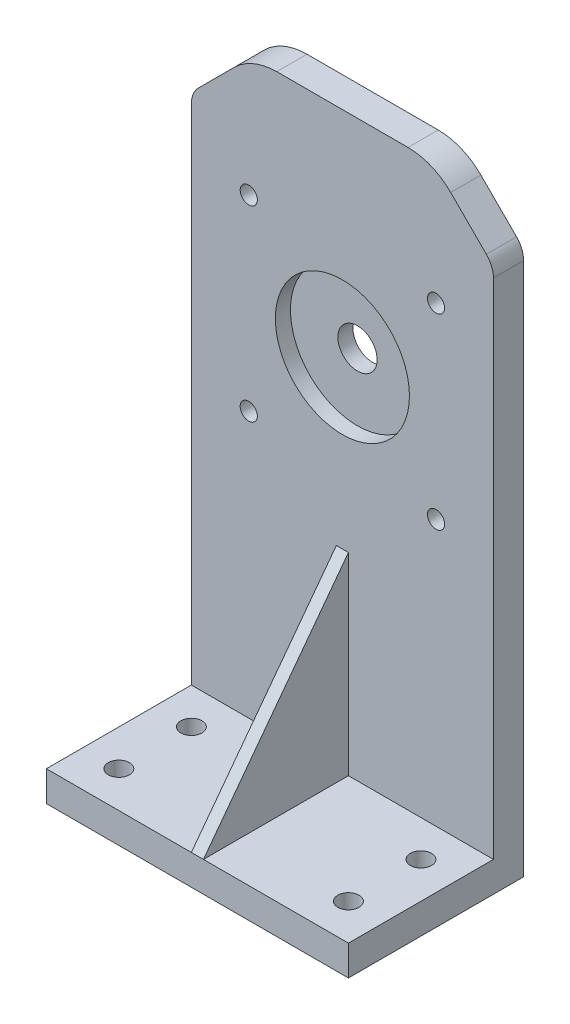
from build123d import *

# Parameters (mm, degrees)
SKETCH1_W           = 50
SKETCH1_H           = 29
BOSS_EXTRUDE1_DEPTH = 5
SKETCH2_W           = 50
SKETCH2_H           = 5
BOSS_EXTRUDE2_DEPTH = 95
SKETCH3_R           = 1.42
CUT_EXTRUDE1_DEPTH  = 60
SKETCH4_R           = 11.1
CUT_EXTRUDE2_DEPTH  = 2.5
SKETCH5_R           = 3.25
CUT_EXTRUDE3_DEPTH  = 10
SKETCH6_R           = 1.75
CUT_EXTRUDE4_DEPTH  = 10
SKETCH8_W           = 2
SKETCH8_H           = 24
BOSS_EXTRUDE3_DEPTH = 32
CUT_EXTRUDE5_DEPTH  = 35
CHAMFER1_SIZE       = 10
FILLET2_R           = 10
FILLET3_R           = 4
FILLET4_R           = 4


with BuildPart() as part:
    # Sketch1 → Boss-Extrude1 (new body)
    with BuildSketch(Plane(origin=(0, 0, 0), x_dir=(1, 0, 0), z_dir=(0, 1, 0))):
        Rectangle(SKETCH1_W, SKETCH1_H)
    extrude(amount=BOSS_EXTRUDE1_DEPTH)

    # Sketch2 → Boss-Extrude2 (add)
    with BuildSketch(Plane(origin=(0, 5, 0), x_dir=(1, 0, 0), z_dir=(0, 1, 0))):
        with Locations((0, 12)):
            Rectangle(SKETCH2_W, SKETCH2_H)
    extrude(amount=BOSS_EXTRUDE2_DEPTH)

    # Sketch3 → Cut-Extrude1 (cut)
    with BuildSketch(Plane.XY.offset(-9.5)):
        with Locations((-15.5, 49)):
            Circle(SKETCH3_R)
        with Locations((15.5, 49)):
            Circle(SKETCH3_R)
        with Locations((15.5, 80)):
            Circle(SKETCH3_R)
        with Locations((-15.5, 80)):
            Circle(SKETCH3_R)
    extrude(amount=-CUT_EXTRUDE1_DEPTH, mode=Mode.SUBTRACT)

    # Sketch4 → Cut-Extrude2 (cut)
    with BuildSketch(Plane.XY.offset(-9.5)):
        with Locations((0, 64.5)):
            Circle(SKETCH4_R)
    extrude(amount=-CUT_EXTRUDE2_DEPTH, mode=Mode.SUBTRACT)

    # Sketch5 → Cut-Extrude3 (cut)
    with BuildSketch(Plane.XY.offset(-12)):
        with Locations((0, 64.5)):
            Circle(SKETCH5_R)
    extrude(amount=-CUT_EXTRUDE3_DEPTH, mode=Mode.SUBTRACT)

    # Sketch6 → Cut-Extrude4 (cut)
    with BuildSketch(Plane(origin=(0, 5, 0), x_dir=(1, 0, 0), z_dir=(0, 1, 0))):
        with Locations(Location((-19, 3.5, 0), (0, 0, 270))):
            Circle(SKETCH6_R)
        with Locations(Location((-19, -8.5, 0), (0, 0, 270))):
            Circle(SKETCH6_R)
        with Locations(Location((19, -8.5, 0), (0, 0, 270))):
            Circle(SKETCH6_R)
        with Locations(Location((19, 3.5, 0), (0, 0, 270))):
            Circle(SKETCH6_R)
    extrude(amount=-CUT_EXTRUDE4_DEPTH, mode=Mode.SUBTRACT)

    # Sketch8 → Boss-Extrude3 (add)
    with BuildSketch(Plane(origin=(0, 5, 0), x_dir=(1, 0, 0), z_dir=(0, 1, 0))):
        with Locations((0, -2.5)):
            Rectangle(SKETCH8_W, SKETCH8_H)
    extrude(amount=BOSS_EXTRUDE3_DEPTH)

    # Sketch9 → Cut-Extrude5 (cut)
    with BuildSketch(Plane(origin=(1, 0, 0), x_dir=(0, 0, -1), z_dir=(1, 0, 0))):
        Polygon((9.5, 37), (-14.5, 5), (-14.5, 37), align=None)
    extrude(amount=-CUT_EXTRUDE5_DEPTH, mode=Mode.SUBTRACT)

    # Chamfer1
    chamfer1_edges = [part.edges().sort_by_distance(p)[0] for p in [
        (-25, 100, -12),
        (25, 100, -12),
    ]]
    chamfer(chamfer1_edges, length=CHAMFER1_SIZE)

    # Fillet2
    fillet2_edges = [part.edges().sort_by_distance(p)[0] for p in [
        (15, 100, -12),
        (-15, 100, -12),
    ]]
    fillet(fillet2_edges, radius=FILLET2_R)

    # Fillet3
    fillet3_edges = [part.edges().sort_by_distance(p)[0] for p in [
        (25, 90, -12),
    ]]
    fillet(fillet3_edges, radius=FILLET3_R)

    # Fillet4
    fillet4_edges = [part.edges().sort_by_distance(p)[0] for p in [
        (-25, 90, -12),
    ]]
    fillet(fillet4_edges, radius=FILLET4_R)


solid = part.part
